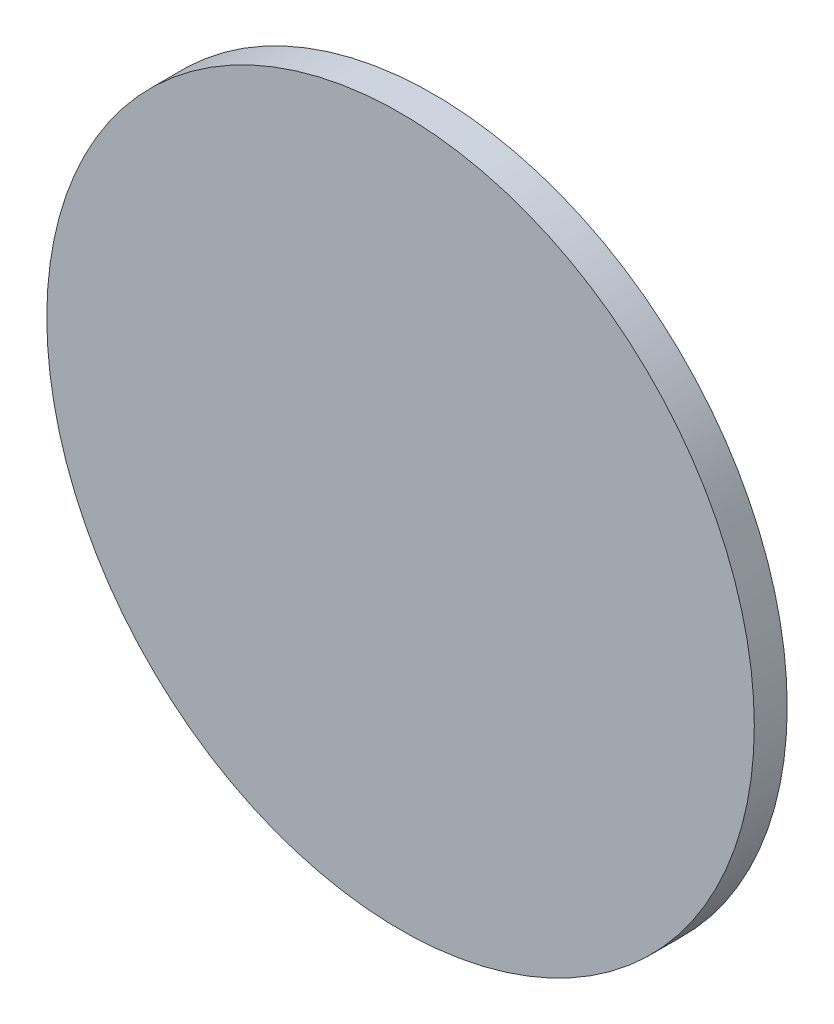
from build123d import *

# Parameters (mm, degrees)
SKETCH3_R           = 107.5
BOSS_EXTRUDE1_DEPTH = 10


with BuildPart() as part:
    # Sketch3 → Boss-Extrude1 (new body)
    with BuildSketch(Plane.XY):
        Circle(SKETCH3_R)
    extrude(amount=BOSS_EXTRUDE1_DEPTH)


solid = part.part
